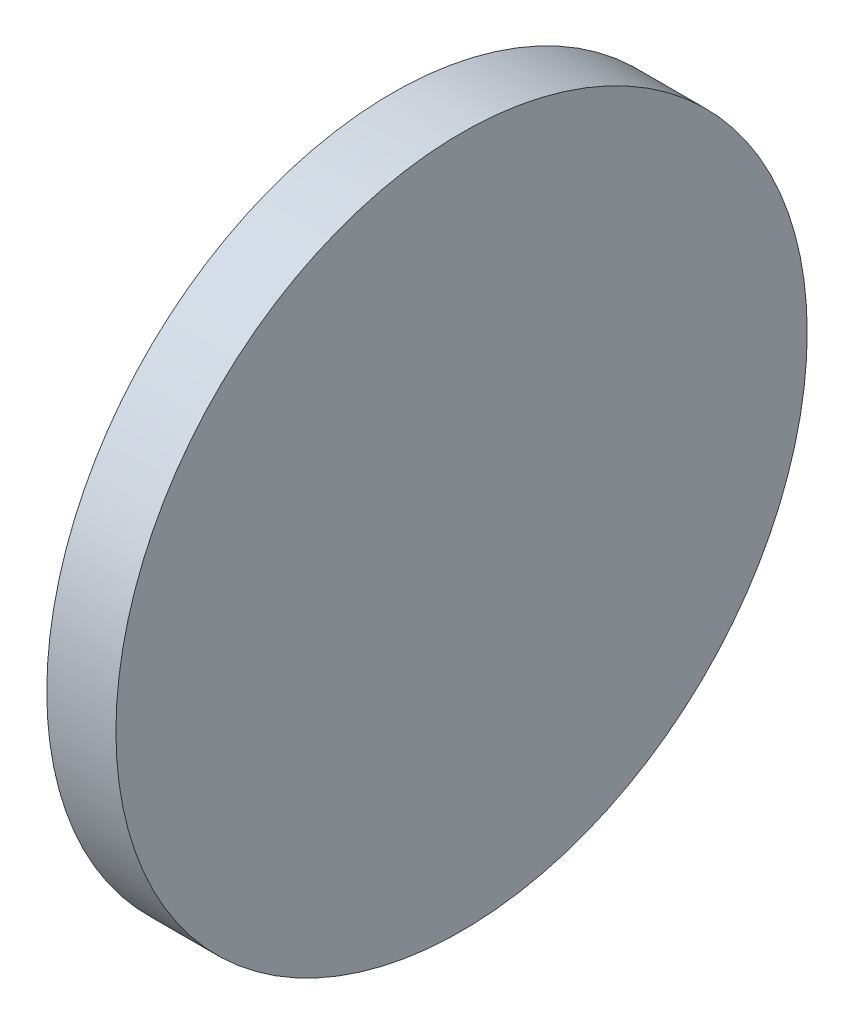
from build123d import *


with BuildPart() as part:
    # 草图7 → 旋转1 (revolve)
    with BuildSketch(Plane(origin=(0, 0, 0), x_dir=(0, 0, -1), z_dir=(0, 1, 0))):
        with BuildLine():
            Line((0, 0), (150, 0))
            Line((150, 0), (150, 30))
            Line((150, 30), (128.5, 30))
            ThreePointArc((128.5, 30), (64.877288014, 16.52186057), (0, 12))
            Line((0, 12), (0, 0))
        make_face()
    revolve(axis=Axis((1000, 0, 0), (-1, 0, 0)))


solid = part.part
